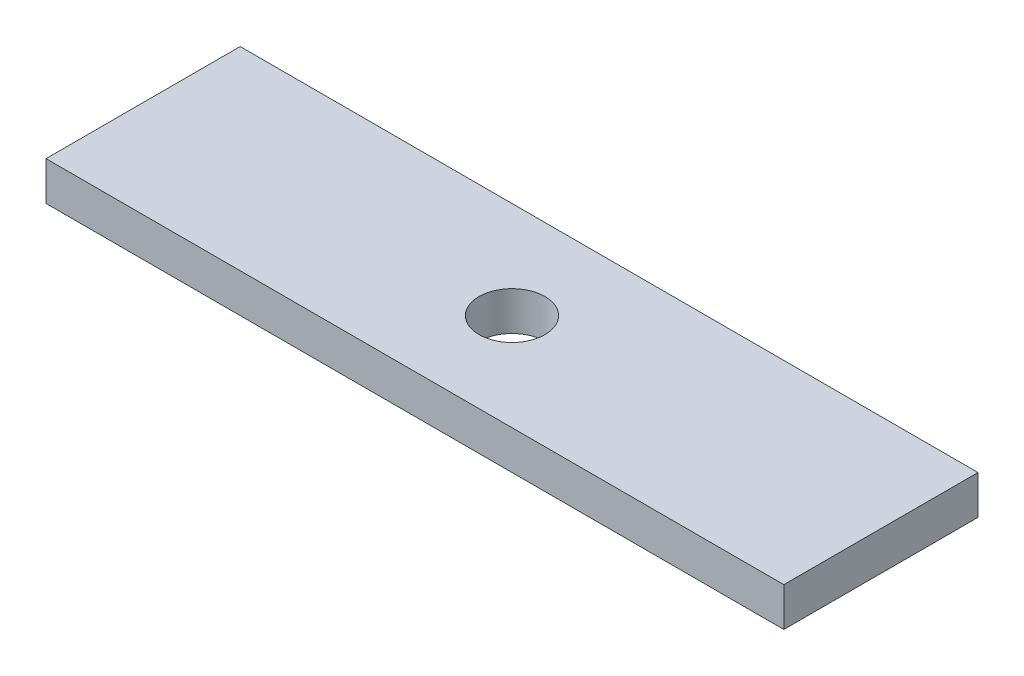
from build123d import *

# Parameters (mm, degrees)
SKETCH_1_W          = 95
SKETCH_1_H          = 25
EXTRUDE_1_DEPTH     = 5
HOLE_WIZARD_M10_1_D = 8.5


with BuildPart() as part:
    # 草图1 → 凸台-拉伸1 (new body)
    with BuildSketch(Plane(origin=(0, 0, 0), x_dir=(1, 0, 0), z_dir=(0, 1, 0))):
        Rectangle(SKETCH_1_W, SKETCH_1_H)
    extrude(amount=EXTRUDE_1_DEPTH)

    # M10 螺纹孔1 (through all)
    with Locations(Plane(origin=(0, 0, 0), x_dir=(-1, 0, 0), z_dir=(0, -1, 0))):
        with Locations((0, 0)):
            Hole(HOLE_WIZARD_M10_1_D / 2)


solid = part.part
